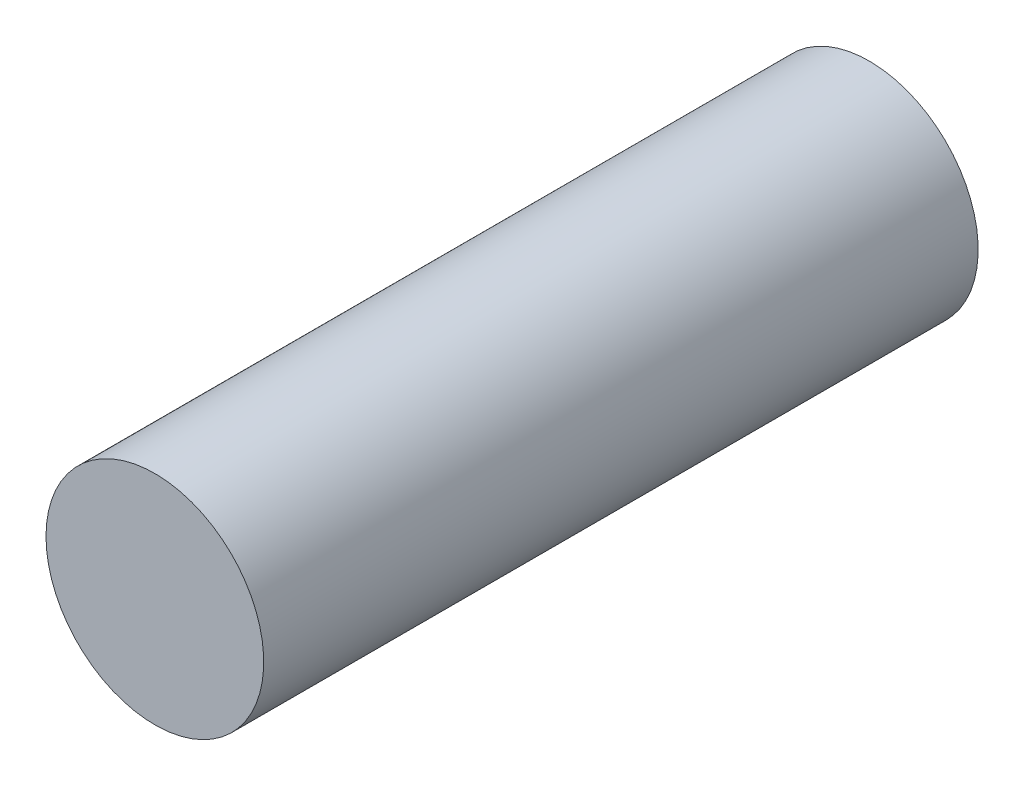
from build123d import *

# Parameters (mm, degrees)
SKETCH1_R           = 3.2
BOSS_EXTRUDE1_DEPTH = 21
SCALE_1_SCALE       = 2


with BuildPart() as part:
    # Sketch1 → Boss-Extrude1 (new body)
    with BuildSketch(Plane.XY):
        with Locations(Location((0, 0, 0), (0, 0, 180))):
            Circle(SKETCH1_R)
    extrude(amount=BOSS_EXTRUDE1_DEPTH)


with BuildPart() as part_1:
    # 缩放比例1: scaled about (0, 0, 10.5)
    add(part.part.scale(SCALE_1_SCALE).moved(Location((0, 0, -10.5))))


solid = part_1.part
